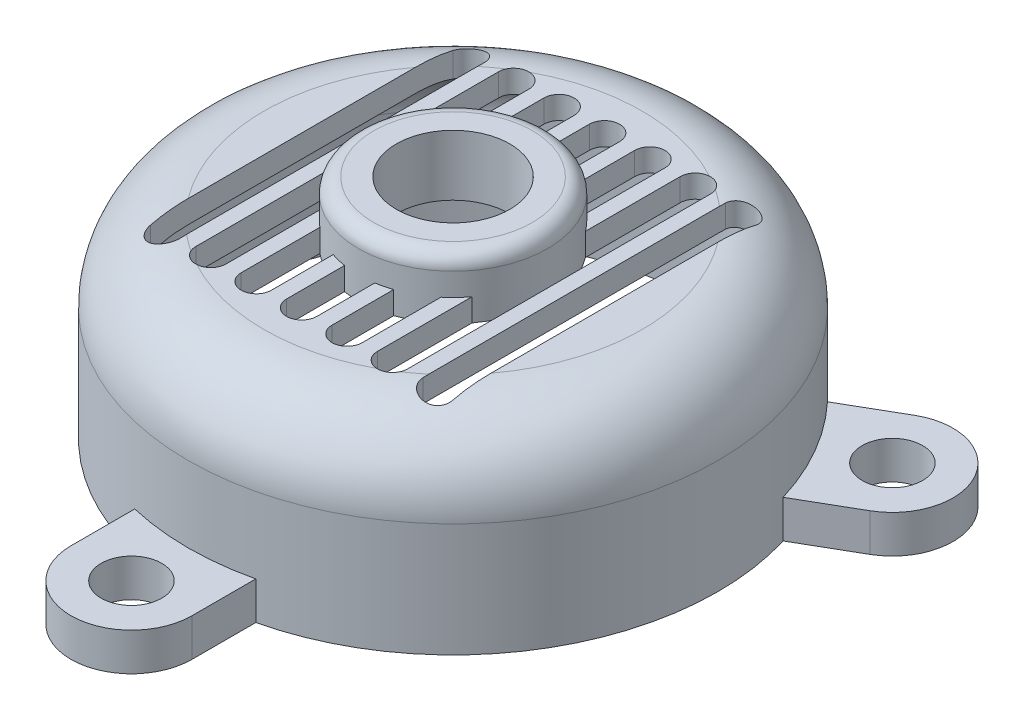
from build123d import *

# Parameters (mm, degrees)
SKETCH1_R                = 35
BOSS_EXTRUDE1_DEPTH      = 25
FILLET1_R                = 10
SHELL1_T                 = -3
SKETCH2_R                = 4
BOSS_EXTRUDE2_DEPTH      = 5
CIRPATTERN1_COUNT        = 3
CUT_EXTRUDE1_DEPTH       = 72.991907702
LPATTERN1_COUNT          = 7
LPATTERN1_PITCH          = 6
BOSS_EXTRUDE3_DEPTH      = 5
BOSS_EXTRUDE3_DEPTH_BACK = 3
SKETCH5_R                = 12.5
SKETCH5_R_2              = 7.5
FILLET2_R                = 2
CUT_EXTRUDE2_DEPTH       = 74.877160033
CUT_EXTRUDE2_DEPTH_BACK  = 74.877160033
SKETCH8_R                = 7.5


with BuildPart() as part:
    # Sketch1 → Boss-Extrude1 (new body)
    with BuildSketch(Plane(origin=(0, 0, 0), x_dir=(1, 0, 0), z_dir=(0, 1, 0))):
        with Locations(Location((0, 0, 0), (0, 0, 270))):
            Circle(SKETCH1_R)
    extrude(amount=BOSS_EXTRUDE1_DEPTH)

    # Fillet1
    fillet1_edges = [part.edges().sort_by_distance(p)[0] for p in [
        (0, 25, -35),
    ]]
    fillet(fillet1_edges, radius=FILLET1_R)

    # Shell1
    shell1_openings = [part.faces().sort_by_distance(p)[0] for p in [
        (0, 0, 0),
    ]]
    offset(amount=SHELL1_T, openings=shell1_openings, kind=Kind.INTERSECTION)

    # Sketch2 → Boss-Extrude2 (add)
    with BuildSketch(Plane.XZ):
        with BuildLine():
            Line((-8, 42.5), (-8, 32.399454667))
            Line((-8, 32.399454667), (8, 32.399454667))
            Line((8, 32.399454667), (8, 42.5))
            ThreePointArc((8, 42.5), (0, 50.5), (-8, 42.5))
        make_face()
        with Locations(Location((0, 42.5, 0), (0, 0, 270))):
            Circle(SKETCH2_R, mode=Mode.SUBTRACT)
    boss_extrude2 = extrude(amount=-BOSS_EXTRUDE2_DEPTH)

    # CirPattern1: Boss-Extrude2 ×3 about axis
    cirpattern1_axis = Axis((0, 0, 0), (0, 1, 0))
    for i in range(1, CIRPATTERN1_COUNT):
        add(boss_extrude2.rotate(cirpattern1_axis, i * 360 / CIRPATTERN1_COUNT))

    # Sketch3 → Cut-Extrude1 (cut, through all)
    with BuildSketch(Plane(origin=(0, 25, 0), x_dir=(1, 0, 0), z_dir=(0, 1, 0))):
        with BuildLine():
            Line((-16, 20), (-16, -20))
            ThreePointArc((-16, -20), (-18, -22), (-20, -20))
            Line((-20, -20), (-20, 20))
            ThreePointArc((-20, 20), (-18, 22), (-16, 20))
        make_face()
    cut_extrude1 = extrude(amount=-CUT_EXTRUDE1_DEPTH, mode=Mode.SUBTRACT)

    # LPattern1: Cut-Extrude1 ×7
    with Locations(*[(i * LPATTERN1_PITCH, 0, 0) for i in range(1, LPATTERN1_COUNT)]):
        add(cut_extrude1, mode=Mode.SUBTRACT)

    # Sketch5 → Boss-Extrude3 (add, two sides: drawn at the far end of the back side and taken through both)
    with BuildSketch(Plane(origin=(0, 25, 0), x_dir=(1, 0, 0), z_dir=(0, 1, 0)).offset(-BOSS_EXTRUDE3_DEPTH_BACK)):
        with Locations(Location((0, 0, 0), (0, 0, 270))):
            Circle(SKETCH5_R)
        with Locations(Location((0, 0, 0), (0, 0, 270))):
            Circle(SKETCH5_R_2, mode=Mode.SUBTRACT)
    extrude(amount=BOSS_EXTRUDE3_DEPTH + BOSS_EXTRUDE3_DEPTH_BACK)

    # Fillet2
    fillet2_edges = [part.edges().sort_by_distance(p)[0] for p in [
        (0, 30, -12.5),
    ]]
    fillet(fillet2_edges, radius=FILLET2_R)

    # Sketch8 → Cut-Extrude2 (cut, two sides: drawn at the far end of the back side and taken through both)
    with BuildSketch(Plane(origin=(0, 30, 0), x_dir=(1, 0, 0), z_dir=(0, 1, 0)).offset(-CUT_EXTRUDE2_DEPTH_BACK)):
        with Locations(Location((0, 0, 0), (0, 0, 270))):
            Circle(SKETCH8_R)
    extrude(amount=CUT_EXTRUDE2_DEPTH + CUT_EXTRUDE2_DEPTH_BACK, mode=Mode.SUBTRACT)


solid = part.part
